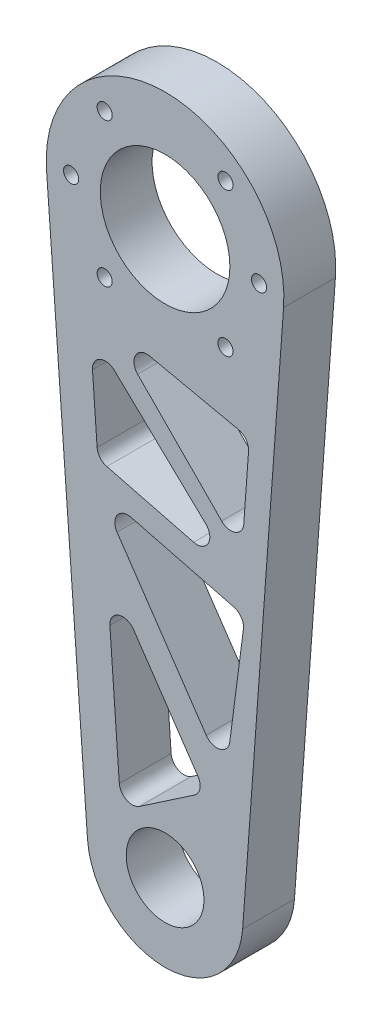
from build123d import *

# Parameters (mm, degrees)
EXTRUDE_1_DEPTH     = 12
SKETCH_2_R          = 1.75
CUT_EXTRUDE_1_DEPTH = 15
SKETCH_3_R          = 15
CUT_EXTRUDE_2_DEPTH = 152.010761206
SKETCH_4_R          = 9
CUT_EXTRUDE_3_DEPTH = 152.010761206
CUT_EXTRUDE_4_DEPTH = 46
FILLET_1_R          = 3


with BuildPart() as part:
    # 草图1 → 凸台-拉伸1 (new body)
    with BuildSketch(Plane.XY):
        with BuildLine():
            Line((-17.951873532, -131.315384615), (-27.426473452, -2.009615385))
            ThreePointArc((-27.426473452, -2.009615385), (0, 27.5), (27.426473452, -2.009615385))
            Line((27.426473452, -2.009615385), (17.951873532, -131.315384615))
            ThreePointArc((17.951873532, -131.315384615), (0, -148), (-17.951873532, -131.315384615))
        make_face()
    extrude(amount=EXTRUDE_1_DEPTH)

    # 草图2 → 切除-拉伸1 (cut)
    with BuildSketch(Plane.XY.offset(12)):
        with Locations((-13.980630511, 16.661466638)):
            Circle(SKETCH_2_R)
        with Locations((-21.75, 0)):
            Circle(SKETCH_2_R)
        with Locations((-13.980630511, -16.661466638)):
            Circle(SKETCH_2_R)
        with Locations((13.980630511, -16.661466638)):
            Circle(SKETCH_2_R)
        with Locations((21.75, 0)):
            Circle(SKETCH_2_R)
        with Locations((13.980630511, 16.661466638)):
            Circle(SKETCH_2_R)
    extrude(amount=-CUT_EXTRUDE_1_DEPTH, mode=Mode.SUBTRACT)

    # 草图3 → 切除-拉伸2 (cut, through all)
    with BuildSketch(Plane.XY.offset(12)):
        Circle(SKETCH_3_R)
    extrude(amount=-CUT_EXTRUDE_2_DEPTH, mode=Mode.SUBTRACT)

    # 草图4 → 切除-拉伸3 (cut, through all)
    with BuildSketch(Plane.XY.offset(12)):
        with Locations((0, -130)):
            Circle(SKETCH_4_R)
    extrude(amount=-CUT_EXTRUDE_3_DEPTH, mode=Mode.SUBTRACT)

    # 草图5 → 切除-拉伸4 (cut)
    with BuildSketch(Plane.XY.offset(12)):
        Polygon((-13.435471405, -25.082066527), (19.516134608, -32.237272404), (17.727418447, -56.648996486), align=None)
        Polygon((-17.358092238, -28.828340185), (-15.578532958, -53.783302593), (17.727418447, -62.299703149), align=None)
        Polygon((-15.56602545, -59.74235485), (18.480575735, -68.448141084), (13.945389013, -103.211738941), align=None)
        Polygon((-13.572905823, -74.67479367), (9.289595148, -108.350537584), (-10.226621526, -121.600119355), align=None)
    extrude(amount=-CUT_EXTRUDE_4_DEPTH, mode=Mode.SUBTRACT)

    # 圆角1
    fillet_1_edges = [part.edges().sort_by_distance(p)[0] for p in [
        (13.945389013, -103.211738941, 6),
        (-15.56602545, -59.74235485, 6),
        (18.480575735, -68.448141084, 6),
        (-17.358092238, -28.828340185, 6),
        (17.727418447, -62.299703149, 6),
        (-15.578532958, -53.783302593, 6),
        (9.289595148, -108.350537584, 6),
        (-10.226621526, -121.600119355, 6),
        (-13.572905823, -74.67479367, 6),
        (17.727418447, -56.648996486, 6),
        (-13.435471405, -25.082066527, 6),
        (19.516134608, -32.237272404, 6),
    ]]
    fillet(fillet_1_edges, radius=FILLET_1_R)


solid = part.part
